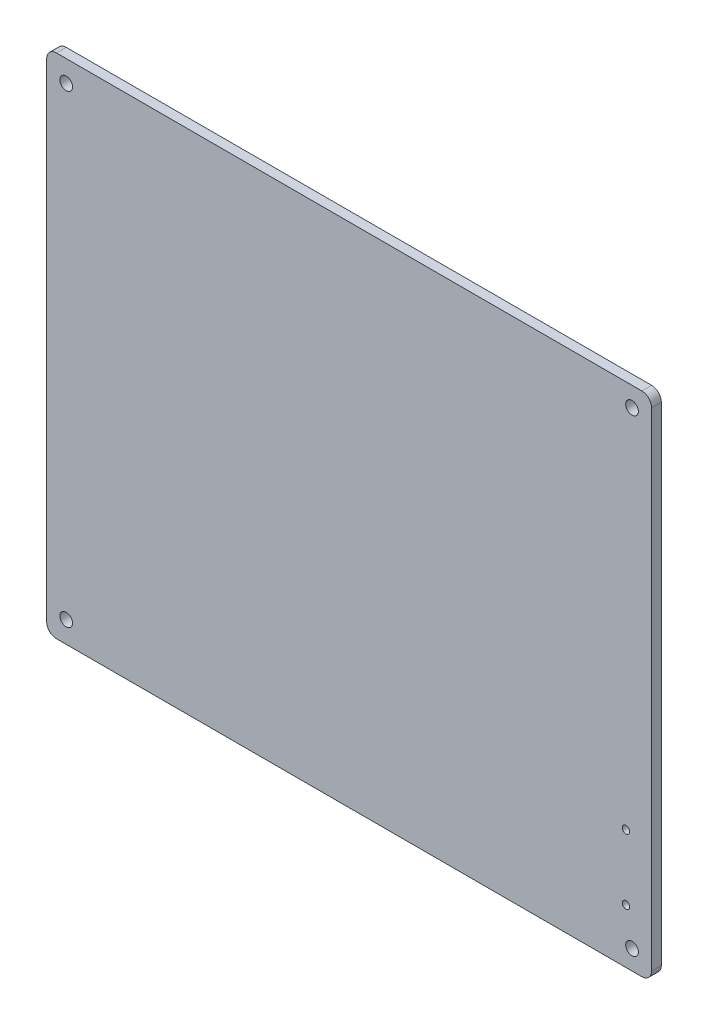
from build123d import *

# Parameters (mm, degrees)
SKETCH1_R           = 3.25
SKETCH1_R_2         = 1.9
BOSS_EXTRUDE1_DEPTH = 5


with BuildPart() as part:
    # Sketch1 → Boss-Extrude1 (new body)
    with BuildSketch(Plane.XY):
        with BuildLine():
            Line((-295, -10), (5, -10))
            ThreePointArc((5, -10), (8.535533906, -8.535533906), (10, -5))
            Line((10, -5), (10, 245))
            ThreePointArc((10, 245), (8.535533906, 248.535533906), (5, 250))
            Line((5, 250), (-295, 250))
            ThreePointArc((-295, 250), (-298.535533906, 248.535533906), (-300, 245))
            Line((-300, 245), (-300, -5))
            ThreePointArc((-300, -5), (-298.535533906, -8.535533906), (-295, -10))
        make_face()
        Circle(SKETCH1_R, mode=Mode.SUBTRACT)
        with Locations((0, 240)):
            Circle(SKETCH1_R, mode=Mode.SUBTRACT)
        with Locations((-290, 239)):
            Circle(SKETCH1_R, mode=Mode.SUBTRACT)
        with Locations((-290, 1)):
            Circle(SKETCH1_R, mode=Mode.SUBTRACT)
        with Locations((-3.100000029, 17.782619509)):
            Circle(SKETCH1_R_2, mode=Mode.SUBTRACT)
        with Locations((-3.100000029, 51.217380491)):
            Circle(SKETCH1_R_2, mode=Mode.SUBTRACT)
    extrude(amount=BOSS_EXTRUDE1_DEPTH)


solid = part.part
